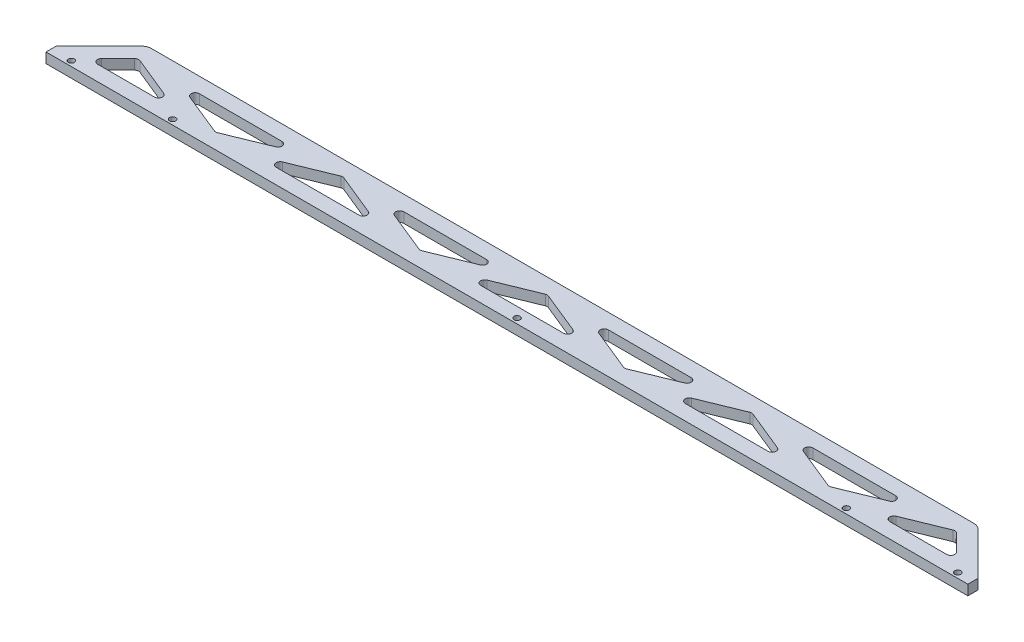
from build123d import *

# Parameters (mm, degrees)
BOSS_EXTRUDE1_DEPTH       = 6.35
FILLET1_R                 = 6.35
CUT_EXTRUDE1_DEPTH        = 6.35
FILLET2_R                 = 2.54
F_6_CLEARANCE_HOLE1_D     = 3.7973
F_6_CLEARANCE_HOLE1_DEPTH = 12.7
F_6_CLEARANCE_HOLE1_TIP   = 1.140824014


with BuildPart() as part:
    # Sketch1 → Boss-Extrude1 (new body)
    with BuildSketch(Plane(origin=(0, 0, 0), x_dir=(1, 0, 0), z_dir=(0, 1, 0))):
        Polygon((0, 6.35), (0, 0), (577.85, 0), (577.85, 6.35), (549.275, 34.925), (28.575, 34.925), align=None)
    extrude(amount=BOSS_EXTRUDE1_DEPTH)

    # Fillet1
    fillet1_edges = [part.edges().sort_by_distance(p)[0] for p in [
        (549.275, 3.175, -34.925),
        (28.575, 3.175, -34.925),
    ]]
    fillet(fillet1_edges, radius=FILLET1_R)

    # Sketch2 → Cut-Extrude1 (cut)
    with BuildSketch(Plane(origin=(0, 6.35, 0), x_dir=(1, 0, 0), z_dir=(0, 1, 0))):
        Polygon((16.645384182, 9.525), (71.415498994, 9.525), (32.520384182, 25.4), align=None)
        Polygon((57.726423324, 25.4), (96.621538136, 9.525), (135.516652948, 25.4), align=None)
        Polygon((121.827577279, 9.525), (160.722692091, 25.4), (199.617806903, 9.525), align=None)
        Polygon((185.928731233, 25.4), (224.823846045, 9.525), (263.718960858, 25.4), align=None)
        Polygon((250.029885188, 9.525), (288.925, 25.4), (327.820114812, 9.525), align=None)
        Polygon((314.131039142, 25.4), (353.026153955, 9.525), (391.921268767, 25.4), align=None)
        Polygon((378.232193097, 9.525), (417.127307909, 25.4), (456.022422721, 9.525), align=None)
        Polygon((442.333347052, 25.4), (481.228461864, 9.525), (520.123576676, 25.4), align=None)
        Polygon((561.204615818, 9.525), (506.434501006, 9.525), (545.329615818, 25.4), align=None)
    extrude(amount=-CUT_EXTRUDE1_DEPTH, mode=Mode.SUBTRACT)

    # Fillet2
    fillet2_edges = [part.edges().sort_by_distance(p)[0] for p in [
        (545.329615818, 3.175, -25.4),
        (442.333347052, 3.175, -25.4),
        (391.921268767, 3.175, -25.4),
        (417.127307909, 3.175, -25.4),
        (288.925, 3.175, -25.4),
        (314.131039142, 3.175, -25.4),
        (185.928731233, 3.175, -25.4),
        (263.718960858, 3.175, -25.4),
        (520.123576676, 3.175, -25.4),
        (481.228461864, 3.175, -9.525),
        (353.026153955, 3.175, -9.525),
        (224.823846045, 3.175, -9.525),
        (250.029885188, 3.175, -9.525),
        (378.232193097, 3.175, -9.525),
        (506.434501006, 3.175, -9.525),
        (561.204615818, 3.175, -9.525),
        (456.022422721, 3.175, -9.525),
        (327.820114812, 3.175, -9.525),
        (199.617806903, 3.175, -9.525),
        (121.827577279, 3.175, -9.525),
        (160.722692091, 3.175, -25.4),
        (135.516652948, 3.175, -25.4),
        (57.726423324, 3.175, -25.4),
        (96.621538136, 3.175, -9.525),
        (71.415498994, 3.175, -9.525),
        (32.520384182, 3.175, -25.4),
        (16.645384182, 3.175, -9.525),
    ]]
    fillet(fillet2_edges, radius=FILLET2_R)

    # #6 Clearance Hole1
    with Locations(Plane(origin=(0, 6.35, 0), x_dir=(1, 0, 0), z_dir=(0, 1, 0))):
        with Locations((12.7, 3.175), (76.2, 3.175), (292.1, 3.175), (568.325, 3.175), (498.475, 3.175)):
            Hole(F_6_CLEARANCE_HOLE1_D / 2, depth=F_6_CLEARANCE_HOLE1_DEPTH)
            with Locations((0, 0, -(F_6_CLEARANCE_HOLE1_DEPTH + F_6_CLEARANCE_HOLE1_TIP / 2))):  # 118° drill point
                Cone(0, F_6_CLEARANCE_HOLE1_D / 2, F_6_CLEARANCE_HOLE1_TIP, mode=Mode.SUBTRACT)


solid = part.part
